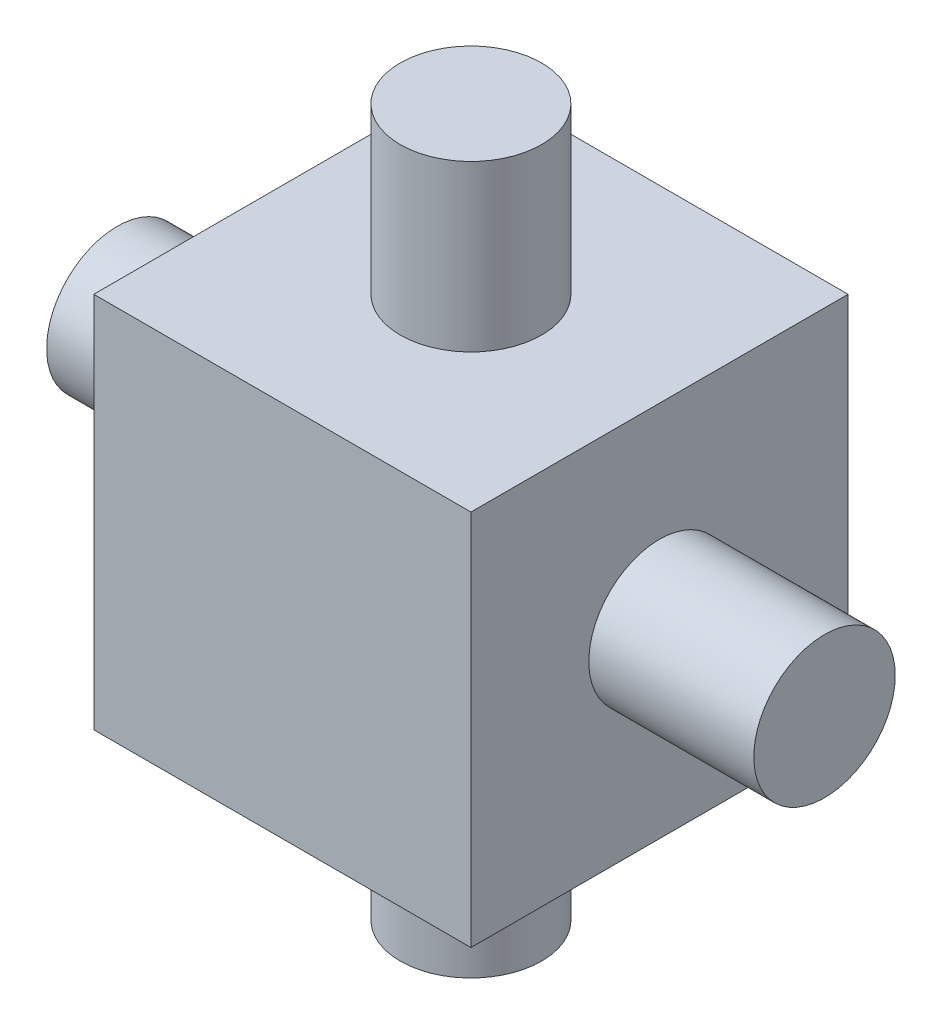
from build123d import *

# Parameters (mm, degrees)
SKETCH1_W           = 40
SKETCH1_H           = 40
BOSS_EXTRUDE1_DEPTH = 40
SKETCH2_R           = 7.5
BOSS_EXTRUDE2_DEPTH = 17.5
SKETCH3_R           = 7.5
BOSS_EXTRUDE3_DEPTH = 17.5


with BuildPart() as part:
    # Sketch1 → Boss-Extrude1 (new body)
    with BuildSketch(Plane.XY):
        Rectangle(SKETCH1_W, SKETCH1_H)
    extrude(amount=BOSS_EXTRUDE1_DEPTH)

    # Sketch2 → Boss-Extrude2 (add)
    with BuildSketch(Plane(origin=(0, 20, 0), x_dir=(1, 0, 0), z_dir=(0, 1, 0))):
        with Locations(Location((0, -20, 0), (0, 0, 270))):
            Circle(SKETCH2_R)
    boss_extrude2 = extrude(amount=BOSS_EXTRUDE2_DEPTH)

    # Mirror1: Boss-Extrude2 across plane
    add(boss_extrude2.mirror(Plane.ZX))

    # Sketch3 → Boss-Extrude3 (add)
    with BuildSketch(Plane(origin=(20, 0, 0), x_dir=(0, 0, -1), z_dir=(1, 0, 0))):
        with Locations((-20, 0)):
            Circle(SKETCH3_R)
    boss_extrude3 = extrude(amount=BOSS_EXTRUDE3_DEPTH)

    # Mirror2: Boss-Extrude3 across plane
    add(boss_extrude3.mirror(Plane(origin=(0, 0, 0), x_dir=(0, 0, 1), z_dir=(1, 0, 0))))


solid = part.part
